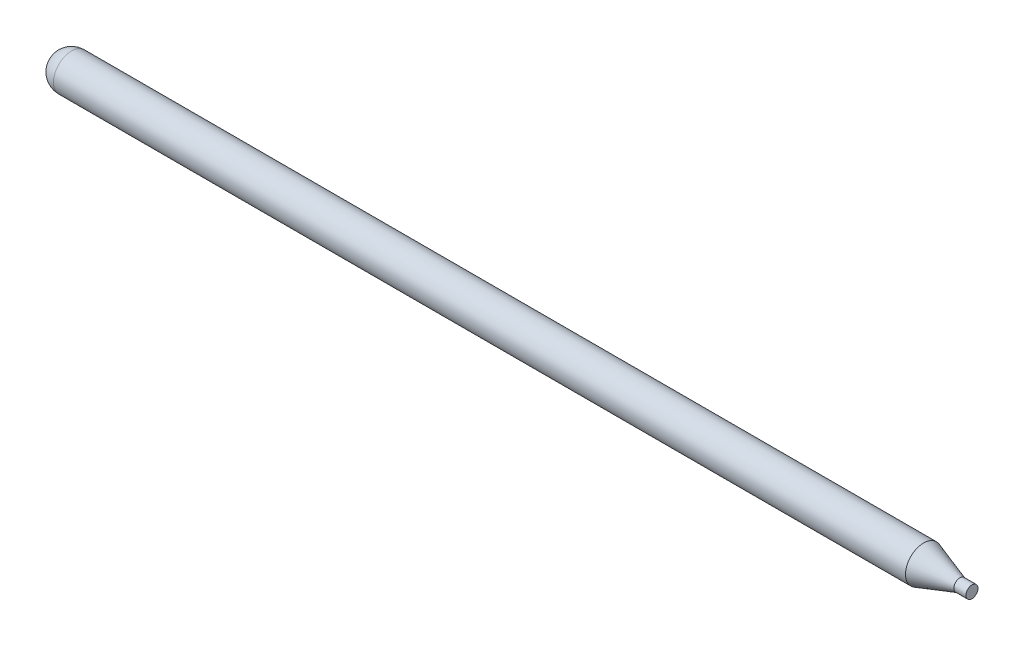
from build123d import *


with BuildPart() as part:
    # Croquis1 → Revolución3 (revolve)
    with BuildSketch(Plane.XY, mode=Mode.PRIVATE) as revoluci_n3_sk:
        with BuildLine():
            Line((72, 3), (78, 1))
            Line((78, 1), (80, 1))
            Line((80, 1), (80, 0))
            Line((80, 0), (78, 0))
            Line((78, 0), (72, 0))
            Line((72, 0), (-72, 0))
            ThreePointArc((-72, 0), (-71.121320344, 2.121320344), (-69, 3))
            Line((-69, 3), (72, 3))
        make_face()
    revolve(revoluci_n3_sk.sketch.rotate(Axis((-72, 0, 0), (1, 0, 0)), 90), axis=Axis((-72, 0, 0), (1, 0, 0)))


solid = part.part
